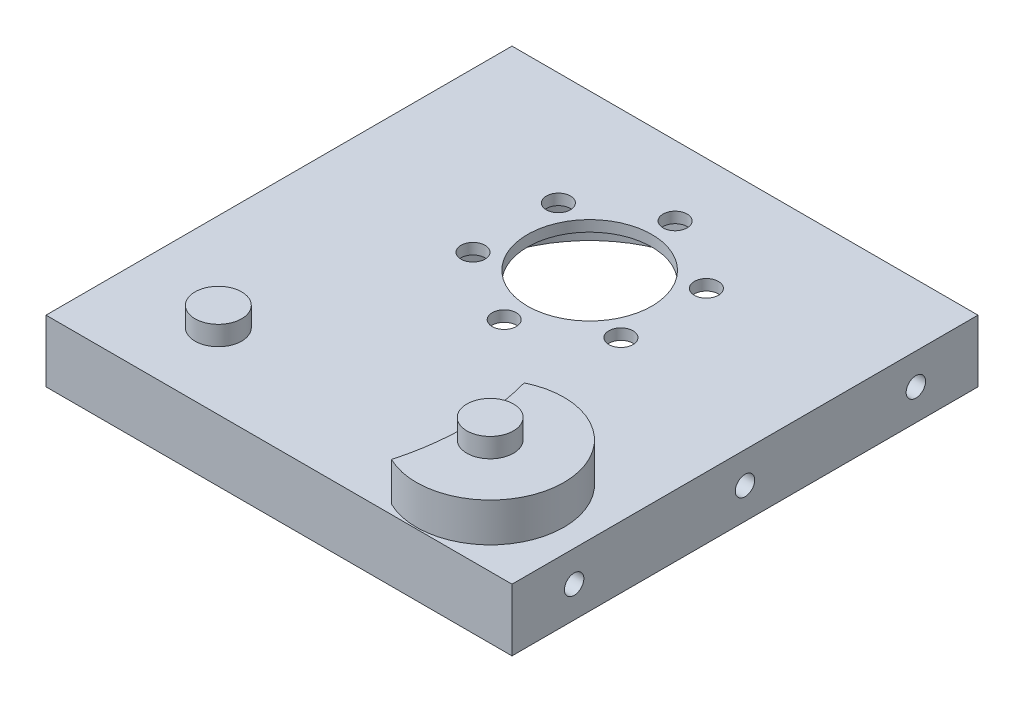
from build123d import *

# Parameters (mm, degrees)
SKETCH1_W                  = 60
SKETCH1_H                  = 60
SKETCH1_R                  = 16
BOSS_EXTRUDE1_DEPTH        = 8
SKETCH2_R                  = 3
BOSS_EXTRUDE2_DEPTH        = 2.5
SKETCH7_R                  = 3
BOSS_EXTRUDE3_DEPTH        = 5
BOSS_EXTRUDE4_DEPTH        = 5
BOSS_EXTRUDE5_START        = -1.4
SKETCH9_R                  = 16
SKETCH9_R_2                = 8
BOSS_EXTRUDE5_DEPTH        = 1.4
SKETCH10_R                 = 1.55
CUT_EXTRUDE2_DEPTH         = 44.17406629
CIRPATTERN1_COUNT          = 6
M3_TAPPED_HOLE2_AT_2_COUNT = 2
M3_TAPPED_HOLE2_AT_2_PITCH = 22
M3_TAPPED_HOLE2_AT_3_COUNT = 2
M3_TAPPED_HOLE2_AT_3_PITCH = 44


with BuildPart() as part:
    # Sketch1 → Boss-Extrude1 (new body)
    with BuildSketch(Plane(origin=(0, 0, 0), x_dir=(1, 0, 0), z_dir=(0, 1, 0))):
        Rectangle(SKETCH1_W, SKETCH1_H)
        with Locations(Location((0, 10, 0), (0, 0, 270))):
            Circle(SKETCH1_R, mode=Mode.SUBTRACT)
    extrude(amount=BOSS_EXTRUDE1_DEPTH)

    # Sketch2 → Boss-Extrude2 (add)
    with BuildSketch(Plane(origin=(0, 8, 0), x_dir=(1, 0, 0), z_dir=(0, 1, 0))):
        with Locations(Location((-17.5, -20.310889132, 0), (0, 0, 270))):
            Circle(SKETCH2_R)
        with Locations(Location((17.5, -20.310889132, 0), (0, 0, 270))):
            Circle(SKETCH2_R)
    extrude(amount=BOSS_EXTRUDE2_DEPTH)

    # Sketch7 → Boss-Extrude3 (add)
    with BuildSketch(Plane(origin=(0, 10.5, 0), x_dir=(1, 0, 0), z_dir=(0, 1, 0))):
        with Locations(Location((17.5, -20.310889132, 0), (0, 0, 270))):
            Circle(SKETCH7_R)
    extrude(amount=BOSS_EXTRUDE3_DEPTH)

    # Sketch8 → Boss-Extrude4 (add)
    with BuildSketch(Plane(origin=(0, 8, 0), x_dir=(1, 0, 0), z_dir=(0, 1, 0))):
        with BuildLine():
            ThreePointArc((13.339285714, -28.851290565), (27, -20.310889132), (13.339285714, -11.7704877))
            ThreePointArc((13.339285714, -11.7704877), (14.5, -20.310889132), (13.339285714, -28.851290565))
        make_face()
    extrude(amount=BOSS_EXTRUDE4_DEPTH)

    # Sketch9 → Boss-Extrude5 (add)
    with BuildSketch(Plane(origin=(0, 8, 0), x_dir=(1, 0, 0), z_dir=(0, 1, 0)).offset(BOSS_EXTRUDE5_START)):
        with Locations(Location((0, 10, 0), (0, 0, 270))):
            Circle(SKETCH9_R)
        with Locations(Location((0, 10, 0), (0, 0, 270))):
            Circle(SKETCH9_R_2, mode=Mode.SUBTRACT)
    extrude(amount=BOSS_EXTRUDE5_DEPTH)

    # Sketch10 → Cut-Extrude2 (cut, through all)
    with BuildSketch(Plane(origin=(0, 8, 0), x_dir=(1, 0, 0), z_dir=(0, 1, 0))):
        with Locations(Location((0, 21, 0), (0, 0, 270))):
            Circle(SKETCH10_R)
    cut_extrude2 = extrude(amount=-CUT_EXTRUDE2_DEPTH, mode=Mode.SUBTRACT)

    # CirPattern1: Cut-Extrude2 ×6 about axis
    cirpattern1_axis = Axis((0, 0, -10), (0, 1, 0))
    for i in range(1, CIRPATTERN1_COUNT):
        add(cut_extrude2.rotate(cirpattern1_axis, i * 360 / CIRPATTERN1_COUNT), mode=Mode.SUBTRACT)

    # Sketch16 → M3 Tapped Hole2 (revolve, cut)
    with BuildSketch(Plane(origin=(30, 4, 22), x_dir=(0, 0, -1), z_dir=(0, 1, 0))):
        Polygon((0, 0), (0, 8.251075774), (1.25, 7.5), (1.25, 0), align=None)
    m3_tapped_hole2 = revolve(axis=Axis((36.35, 4, 22), (-1, 0, 0)), mode=Mode.SUBTRACT)

    # M3 Tapped Hole2 at 2: M3 Tapped Hole2 ×2
    with Locations(*[(0, 0, -i * M3_TAPPED_HOLE2_AT_2_PITCH) for i in range(1, M3_TAPPED_HOLE2_AT_2_COUNT)]):
        add(m3_tapped_hole2, mode=Mode.SUBTRACT)

    # M3 Tapped Hole2 at 3: M3 Tapped Hole2 ×2
    with Locations(*[(0, 0, -i * M3_TAPPED_HOLE2_AT_3_PITCH) for i in range(1, M3_TAPPED_HOLE2_AT_3_COUNT)]):
        add(m3_tapped_hole2, mode=Mode.SUBTRACT)

    # Mirror1: M3 Tapped Hole2 across plane
    add(m3_tapped_hole2.mirror(Plane(origin=(0, 0, 0), x_dir=(0, 0, 1), z_dir=(1, 0, 0))), mode=Mode.SUBTRACT)

    # Mirror1 copy 1 sketch → Mirror1 copy 1 (revolve, cut)
    with BuildSketch(Plane(origin=(-30, 4, 0), x_dir=(0, 0, -1), z_dir=(0, 1, 0))):
        Polygon((0, 0), (0, -8.251075774), (1.25, -7.5), (1.25, 0), align=None)
    revolve(axis=Axis((-36.35, 4, 0), (-1, 0, 0)), mode=Mode.SUBTRACT)

    # Mirror1 copy 2 sketch → Mirror1 copy 2 (revolve, cut)
    with BuildSketch(Plane(origin=(-30, 4, -22), x_dir=(0, 0, -1), z_dir=(0, 1, 0))):
        Polygon((0, 0), (0, -8.251075774), (1.25, -7.5), (1.25, 0), align=None)
    revolve(axis=Axis((-36.35, 4, -22), (-1, 0, 0)), mode=Mode.SUBTRACT)


solid = part.part
